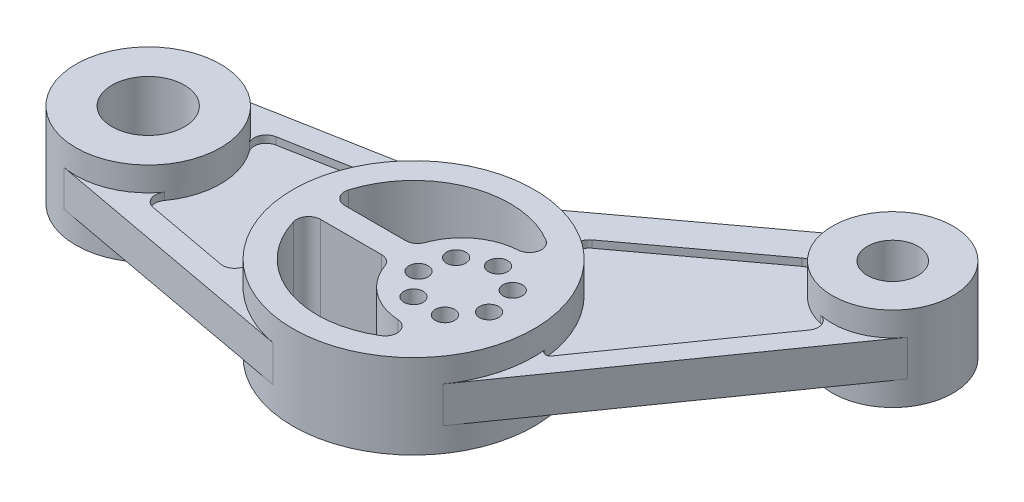
from build123d import *

# Parameters (mm, degrees)
SKETCH1_R             = 22
SKETCH1_R_2           = 4
BOSS_EXTRUDE1_DEPTH   = 35
BOSS_EXTRUDE2_START   = 10
BOSS_EXTRUDE2_DEPTH   = 15
BOSS_EXTRUDE2_2_DEPTH = 15
BOSS_EXTRUDE2_3_DEPTH = 15
BOSS_EXTRUDE2_4_DEPTH = 15
SKETCH1_4_R           = 30
SKETCH1_4_R_2         = 15
SKETCH1_4_R_3         = 25
SKETCH1_4_R_4         = 10.5
BOSS_EXTRUDE3_DEPTH   = 35
BOSS_EXTRUDE5_START   = 11
BOSS_EXTRUDE5_DEPTH   = 11
SKETCH1_7_R           = 22
BOSS_EXTRUDE6_DEPTH   = 35


with BuildPart() as part:
    # Sketch1 → Boss-Extrude1 (new body)
    with BuildSketch(Plane(origin=(0, 0, 0), x_dir=(1, 0, 0), z_dir=(0, 1, 0))):
        Circle(SKETCH1_R)
        with Locations((-6.508256087, -13.514533019)):
            Circle(SKETCH1_R_2, mode=Mode.SUBTRACT)
        with Locations((6.508256087, -13.514533019)):
            Circle(SKETCH1_R_2, mode=Mode.SUBTRACT)
        with Locations((-14.623918683, -3.337814009)):
            Circle(SKETCH1_R_2, mode=Mode.SUBTRACT)
        with Locations((-11.727472237, 9.352347028)):
            Circle(SKETCH1_R_2, mode=Mode.SUBTRACT)
        with Locations((0, 15)):
            Circle(SKETCH1_R_2, mode=Mode.SUBTRACT)
        with Locations((14.623918683, -3.337814009)):
            Circle(SKETCH1_R_2, mode=Mode.SUBTRACT)
        with Locations((11.727472237, 9.352347028)):
            Circle(SKETCH1_R_2, mode=Mode.SUBTRACT)
    extrude(amount=BOSS_EXTRUDE1_DEPTH)



with BuildPart() as body_2:
    # Sketch1<3> → Boss-Extrude2 (new body)
    with BuildSketch(Plane(origin=(0, 0, 0), x_dir=(1, 0, 0), z_dir=(0, 1, 0)).offset(BOSS_EXTRUDE2_START)):
        with BuildLine():
            Line((-29.090909091, 49.166608302), (-135.454545455, 29.499964981))
            ThreePointArc((-135.454545455, 29.499964981), (-118.841537744, 27.847598103), (-105.684210842, 17.57106706))
            ThreePointArc((-105.684210842, 17.57106706), (-106.272845666, 22.359321946), (-102.540670225, 25.416239066))
            Line((-102.540670225, 25.416239066), (-68.238836594, 31.758650348))
            ThreePointArc((-68.238836594, 31.758650348), (-64.040683205, 30.607898174), (-62.335471097, 26.602779686))
            ThreePointArc((-62.335471097, 26.602779686), (-48.07934713, 41.370886681), (-29.090909091, 49.166608302))
        make_face()
    extrude(amount=BOSS_EXTRUDE2_DEPTH)



with BuildPart() as body_3:
    # Sketch1<3> → Boss-Extrude2 2 (new body)
    with BuildSketch(Plane(origin=(0, 0, 0), x_dir=(1, 0, 0), z_dir=(0, 1, 0)).offset(BOSS_EXTRUDE2_START)):
        with BuildLine():
            Line((65.058027183, 118.797588822), (-29.090909091, 49.166608302))
            ThreePointArc((-29.090909091, 49.166608302), (-14.295406408, 49.673510163), (0, 45.82575695))
            ThreePointArc((0, 45.82575695), (-2.026867504, 49.845767293), (0, 53.865777636))
            Line((0, 53.865777636), (50.073723573, 90.899467114))
            ThreePointArc((50.073723573, 90.899467114), (53.176128361, 91.877785359), (56.223814659, 90.740406669))
            ThreePointArc((56.223814659, 90.740406669), (56.077798236, 106.205763396), (65.058027183, 118.797588822))
        make_face()
    extrude(amount=BOSS_EXTRUDE2_2_DEPTH)


with BuildPart() as body_4:
    # Sketch1<3> → Boss-Extrude2 3 (new body)
    with BuildSketch(Plane(origin=(0, 0, 0), x_dir=(1, 0, 0), z_dir=(0, 1, 0)).offset(BOSS_EXTRUDE2_START)):
        with BuildLine():
            ThreePointArc((-105.684210842, -17.57106706), (-118.841537744, -27.847598103), (-135.454545455, -29.499964981))
            Line((-135.454545455, -29.499964981), (-29.090909091, -49.166608302))
            ThreePointArc((-29.090909091, -49.166608302), (-48.07934713, -41.370886681), (-62.335471097, -26.602779686))
            ThreePointArc((-62.335471097, -26.602779686), (-64.040683205, -30.607898174), (-68.238836594, -31.758650348))
            Line((-68.238836594, -31.758650348), (-102.540670225, -25.416239066))
            ThreePointArc((-102.540670225, -25.416239066), (-106.272845666, -22.359321946), (-105.684210842, -17.57106706))
        make_face()
    extrude(amount=BOSS_EXTRUDE2_3_DEPTH)


with BuildPart() as body_5:
    # Sketch1<3> → Boss-Extrude2 4 (new body)
    with BuildSketch(Plane(origin=(0, 0, 0), x_dir=(1, 0, 0), z_dir=(0, 1, 0)).offset(BOSS_EXTRUDE2_START)):
        with BuildLine():
            ThreePointArc((33.280664522, 3.734547986), (31.165717268, 3.098740137), (29.768218703, 4.808784369))
            ThreePointArc((29.768218703, 4.808784369), (28.343242321, -12.76443974), (20.907291105, -28.750539725))
            Line((20.907291105, -28.750539725), (100.377335216, 84.322267243))
            ThreePointArc((100.377335216, 84.322267243), (88.928428781, 75.375558771), (74.437778368, 74.306867224))
            ThreePointArc((74.437778368, 74.306867224), (78.004991776, 71.229681071), (77.43132522, 66.553679275))
            Line((77.43132522, 66.553679275), (33.280664522, 3.734547986))
        make_face()
    extrude(amount=BOSS_EXTRUDE2_4_DEPTH)


with BuildPart() as body_2_1:
    add(body_2.part)

    add(body_3.part)  # Boss-Extrude3 merges body 3

    add(body_4.part)  # Boss-Extrude3 merges body 4

    add(body_5.part)  # Boss-Extrude3 merges body 5
    # Sketch1<4> → Boss-Extrude3 (add)
    # profile 1 of 2: a face of its own
    with BuildSketch(Plane(origin=(0, 0, 0), x_dir=(1, 0, 0), z_dir=(0, 1, 0))):
        with Locations((-130, 0)):
            Circle(SKETCH1_4_R)
        with Locations((-130, 0)):
            Circle(SKETCH1_4_R_2, mode=Mode.SUBTRACT)
    # profile 2 of 2: a face of its own
    with BuildSketch(Plane(origin=(0, 0, 0), x_dir=(1, 0, 0), z_dir=(0, 1, 0))):
        with Locations((79.923689663, 98.697537105)):
            Circle(SKETCH1_4_R_3)
        with Locations((79.923689663, 98.697537105)):
            Circle(SKETCH1_4_R_4, mode=Mode.SUBTRACT)
    extrude(amount=BOSS_EXTRUDE3_DEPTH)

    # Sketch1<6> → Boss-Extrude5 (add)
    with BuildSketch(Plane(origin=(0, 0, 0), x_dir=(1, 0, 0), z_dir=(0, 1, 0)).offset(BOSS_EXTRUDE5_START)):
        with BuildLine():
            ThreePointArc((-102.540670225, 25.416239066), (-106.272845666, 22.359321946), (-105.684210842, 17.57106706))
            ThreePointArc((-105.684210842, 17.57106706), (-100, 0), (-105.684210842, -17.57106706))
            ThreePointArc((-105.684210842, -17.57106706), (-106.272845666, -22.359321946), (-102.540670225, -25.416239066))
            Line((-102.540670225, -25.416239066), (-68.238836594, -31.758650348))
            ThreePointArc((-68.238836594, -31.758650348), (-64.040683205, -30.607898174), (-62.335471097, -26.602779686))
            ThreePointArc((-62.335471097, -26.602779686), (-70, 0), (-62.335471097, 26.602779686))
            ThreePointArc((-62.335471097, 26.602779686), (-64.040683205, 30.607898174), (-68.238836594, 31.758650348))
            Line((-68.238836594, 31.758650348), (-102.540670225, 25.416239066))
        make_face()
        with BuildLine():
            ThreePointArc((0, 53.865777636), (-2.026867504, 49.845767293), (0, 45.82575695))
            ThreePointArc((0, 45.82575695), (20.466023961, 29.368365716), (29.768218703, 4.808784369))
            ThreePointArc((29.768218703, 4.808784369), (31.165717268, 3.098740137), (33.280664522, 3.734547986))
            Line((33.280664522, 3.734547986), (77.43132522, 66.553679275))
            ThreePointArc((77.43132522, 66.553679275), (78.004991776, 71.229681071), (74.437778368, 74.306867224))
            ThreePointArc((74.437778368, 74.306867224), (63.176515718, 80.135959455), (56.223814659, 90.740406669))
            ThreePointArc((56.223814659, 90.740406669), (53.176128361, 91.877785359), (50.073723573, 90.899467114))
            Line((50.073723573, 90.899467114), (0, 53.865777636))
        make_face()
    extrude(amount=BOSS_EXTRUDE5_DEPTH)


with BuildPart() as part_1:
    add(part.part)

    add(body_2_1.part)  # Boss-Extrude6 merges body 2
    # Sketch1<7> → Boss-Extrude6 (add)
    with BuildSketch(Plane(origin=(0, 0, 0), x_dir=(1, 0, 0), z_dir=(0, 1, 0))):
        with BuildLine():
            ThreePointArc((0, 45.82575695), (-14.295406408, 49.673510163), (-29.090909091, 49.166608302))
            ThreePointArc((-29.090909091, 49.166608302), (-48.07934713, 41.370886681), (-62.335471097, 26.602779686))
            ThreePointArc((-62.335471097, 26.602779686), (-70, 0), (-62.335471097, -26.602779686))
            ThreePointArc((-62.335471097, -26.602779686), (-48.07934713, -41.370886681), (-29.090909091, -49.166608302))
            ThreePointArc((-29.090909091, -49.166608302), (-1.098293592, -46.289583006), (20.907291105, -28.750539725))
            ThreePointArc((20.907291105, -28.750539725), (27.672657547, -15.077059474), (30, 0))
            ThreePointArc((30, 0), (29.94202106, 2.407183503), (29.768218703, 4.808784369))
            ThreePointArc((29.768218703, 4.808784369), (20.466023961, 29.368365716), (0, 45.82575695))
        make_face()
        with BuildLine():
            ThreePointArc((-58.3325939, -11.428571429), (-57.549938291, -7.011928477), (-53.541019662, -5))
            Line((-53.541019662, -5), (-28.284271247, -5))
            ThreePointArc((-28.284271247, -5), (-25.397519902, -5.917517095), (-23.57022604, -8.333333333))
            ThreePointArc((-23.57022604, -8.333333333), (-15.064900332, -19.951159815), (-1.5625, -24.951124098))
            ThreePointArc((-1.5625, -24.951124098), (2.980616225, -28.748457023), (0.714285714, -34.218684477))
            ThreePointArc((0.714285714, -34.218684477), (-34.403072902, -37.316906235), (-58.3325939, -11.428571429))
        make_face(mode=Mode.SUBTRACT)
        with BuildLine():
            Line((-28.284271247, 5), (-53.541019662, 5))
            ThreePointArc((-53.541019662, 5), (-57.549938291, 7.011928477), (-58.3325939, 11.428571429))
            ThreePointArc((-58.3325939, 11.428571429), (-34.403072902, 37.316906235), (0.714285714, 34.218684477))
            ThreePointArc((0.714285714, 34.218684477), (2.980616225, 28.748457023), (-1.5625, 24.951124098))
            ThreePointArc((-1.5625, 24.951124098), (-15.064900332, 19.951159815), (-23.57022604, 8.333333333))
            ThreePointArc((-23.57022604, 8.333333333), (-25.397519902, 5.917517095), (-28.284271247, 5))
        make_face(mode=Mode.SUBTRACT)
        Circle(SKETCH1_7_R, mode=Mode.SUBTRACT)
    extrude(amount=BOSS_EXTRUDE6_DEPTH)


solid = part_1.part
